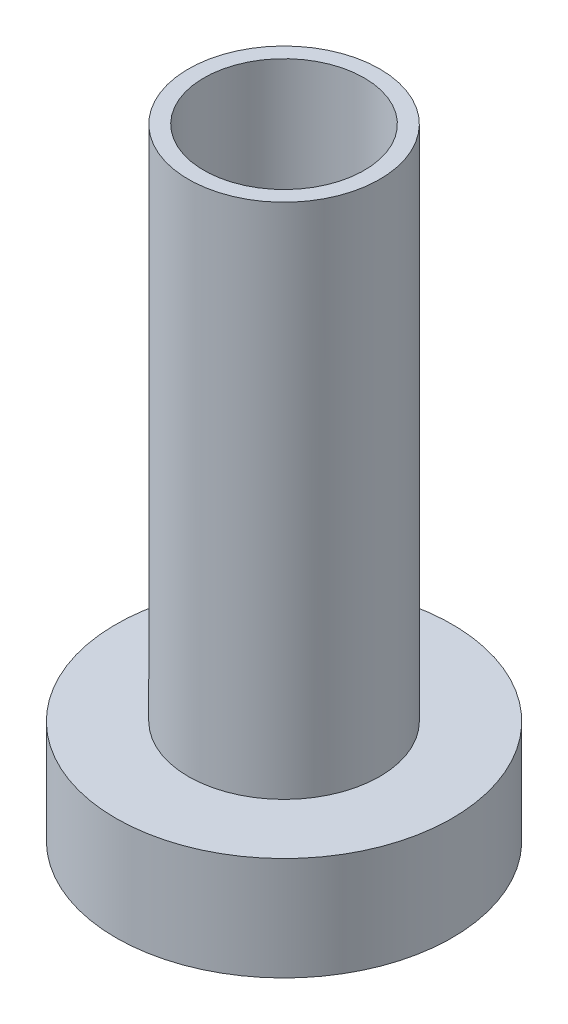
from build123d import *

# Parameters (mm, degrees)
SKETCH1_R           = 3.25
BOSS_EXTRUDE1_DEPTH = 2
SKETCH6_R           = 1.85
BOSS_EXTRUDE3_DEPTH = 12
SKETCH7_R           = 1.55
CUT_EXTRUDE1_DEPTH  = 13.850097276


with BuildPart() as part:
    # Sketch1 → Boss-Extrude1 (new body)
    with BuildSketch(Plane(origin=(0, 0, 0), x_dir=(1, 0, 0), z_dir=(0, 1, 0))):
        with Locations(Location((0, 0, 0), (0, 0, 270))):
            Circle(SKETCH1_R)
    extrude(amount=BOSS_EXTRUDE1_DEPTH)

    # Sketch6 → Boss-Extrude3 (add)
    with BuildSketch(Plane(origin=(0, 0, 0), x_dir=(-1, 0, 0), z_dir=(0, -1, 0))):
        with Locations(Location((0, 0, 0), (0, 0, 90))):
            Circle(SKETCH6_R)
    extrude(amount=-BOSS_EXTRUDE3_DEPTH)

    # Sketch7 → Cut-Extrude1 (cut, through all)
    with BuildSketch(Plane(origin=(0, 0, 0), x_dir=(-1, 0, 0), z_dir=(0, -1, 0))):
        with Locations(Location((0, 0, 0), (0, 0, 90))):
            Circle(SKETCH7_R)
    extrude(amount=-CUT_EXTRUDE1_DEPTH, mode=Mode.SUBTRACT)


solid = part.part
